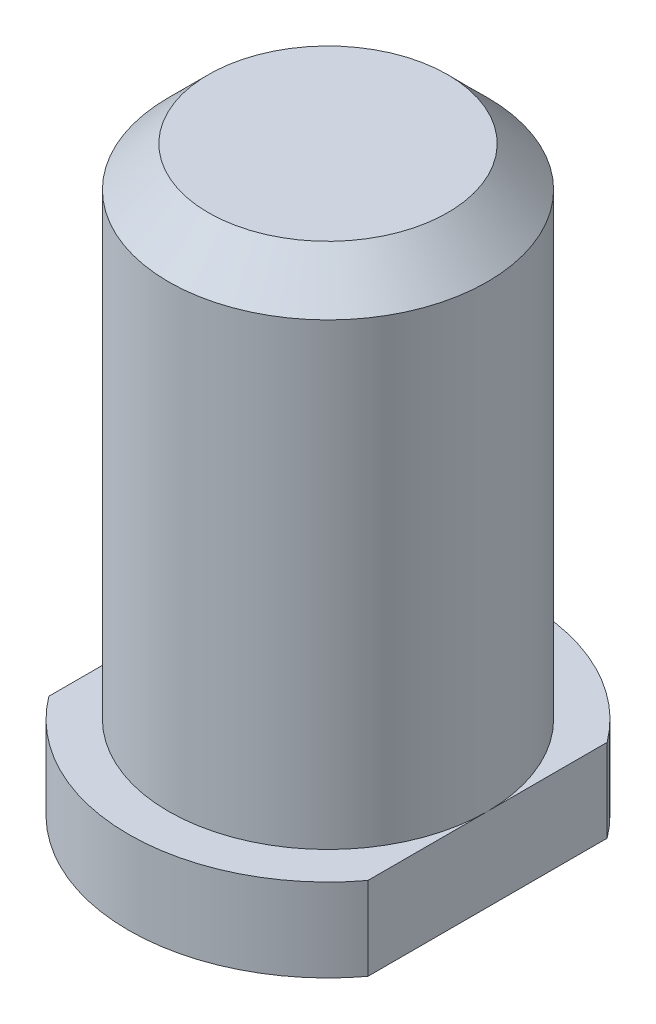
from build123d import *

# Parameters (mm, degrees)
SKETCH1_R           = 3.048
BOSS_EXTRUDE1_DEPTH = 9.525
CHAMFER1_SIZE       = 0.762
SKETCH2_R           = 3.81
BOSS_EXTRUDE2_DEPTH = 1.5875
SKETCH4_W           = 5.15979919
SKETCH4_H           = 9.269210688
SKETCH4_W_2         = 9.619339919
SKETCH4_H_2         = 8.458385102
CUT_EXTRUDE1_DEPTH  = 11.943391842


with BuildPart() as part:
    # Sketch1 → Boss-Extrude1 (new body)
    with BuildSketch(Plane(origin=(0, 0, 0), x_dir=(1, 0, 0), z_dir=(0, 1, 0))):
        with Locations(Location((0, 0, 0), (0, 0, 90))):
            Circle(SKETCH1_R)
    extrude(amount=BOSS_EXTRUDE1_DEPTH)

    # Chamfer1
    chamfer1_edges = [part.edges().sort_by_distance(p)[0] for p in [
        (0, 9.525, 3.048),
    ]]
    chamfer(chamfer1_edges, length=CHAMFER1_SIZE)

    # Sketch2 → Boss-Extrude2 (add)
    with BuildSketch(Plane.XZ):
        with Locations(Location((0, 0, 0), (0, 0, 270))):
            Circle(SKETCH2_R)
    extrude(amount=BOSS_EXTRUDE2_DEPTH)

    # Sketch4 → Cut-Extrude1 (cut, through all)
    with BuildSketch(Plane(origin=(0, 0, 0), x_dir=(1, 0, 0), z_dir=(0, 1, 0))):
        with Locations((-5.627899595, 0)):
            Rectangle(SKETCH4_W, SKETCH4_H)
        with Locations((7.85766996, 0)):
            Rectangle(SKETCH4_W_2, SKETCH4_H_2)
    extrude(amount=-CUT_EXTRUDE1_DEPTH, mode=Mode.SUBTRACT)


solid = part.part
